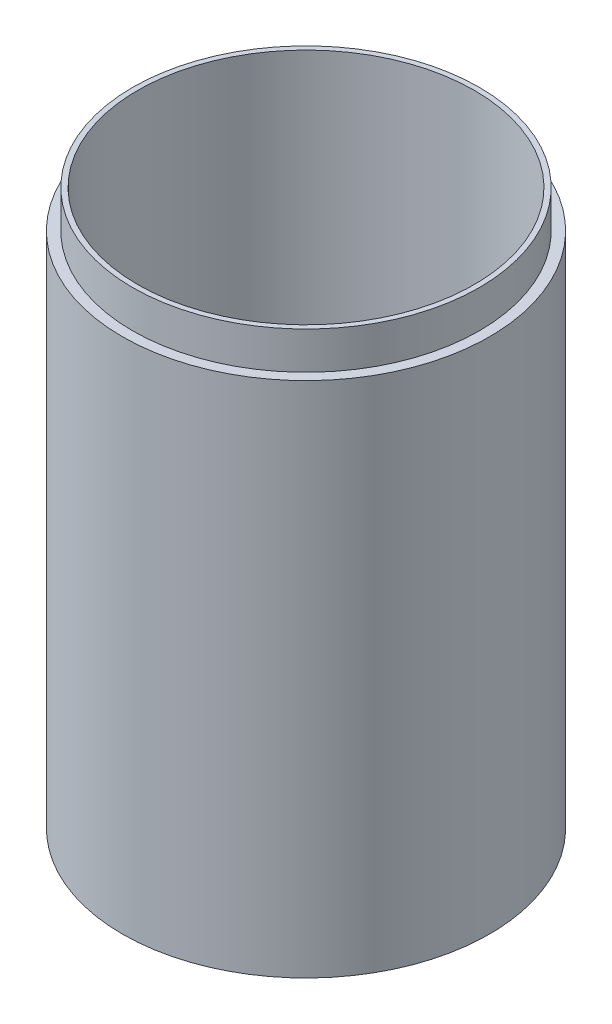
from build123d import *

# Parameters (mm, degrees)
CUT_EXTRUDE1_REACH = 78.278
SKETCH2_R          = 22.225
SKETCH2_R_2        = 21.59


with BuildPart() as part:
    # Sketch1 → Revolve1 (revolve)
    with BuildSketch(Plane.XY, mode=Mode.PRIVATE) as revolve1_sk:
        Polygon((22.86, 0), (22.86, -64.42075), (0, -64.42075), (0, -62.89675), (20.955, -62.89675), (20.955, 4.66725), (22.225, 4.66725), (22.225, 2.286), (21.59, 2.286), (21.59, 0), (22.225, 0), align=None)
    revolve(revolve1_sk.sketch.rotate(Axis((0, 33.267670174, 0), (0, -1, 0)), 90), axis=Axis((0, 33.267670174, 0), (0, -1, 0)))

    # Sketch2 → Cut-Extrude1 (cut, up to next)
    with BuildSketch(Plane(origin=(0, 4.66725, 0), x_dir=(1, 0, 0), z_dir=(0, 1, 0)), mode=Mode.PRIVATE) as cut_extrude1_sk1:
        Circle(SKETCH2_R)
        with Locations(Location((0, 0, 0), (0, 0, 270))):
            Circle(SKETCH2_R_2, mode=Mode.SUBTRACT)
    cut_extrude1_tool1 = extrude(cut_extrude1_sk1.sketch, amount=-CUT_EXTRUDE1_REACH, mode=Mode.PRIVATE) & part.part
    add(cut_extrude1_tool1.solids().sort_by_distance((-21.596382, 4.66725, 0))[0], mode=Mode.SUBTRACT)


solid = part.part
